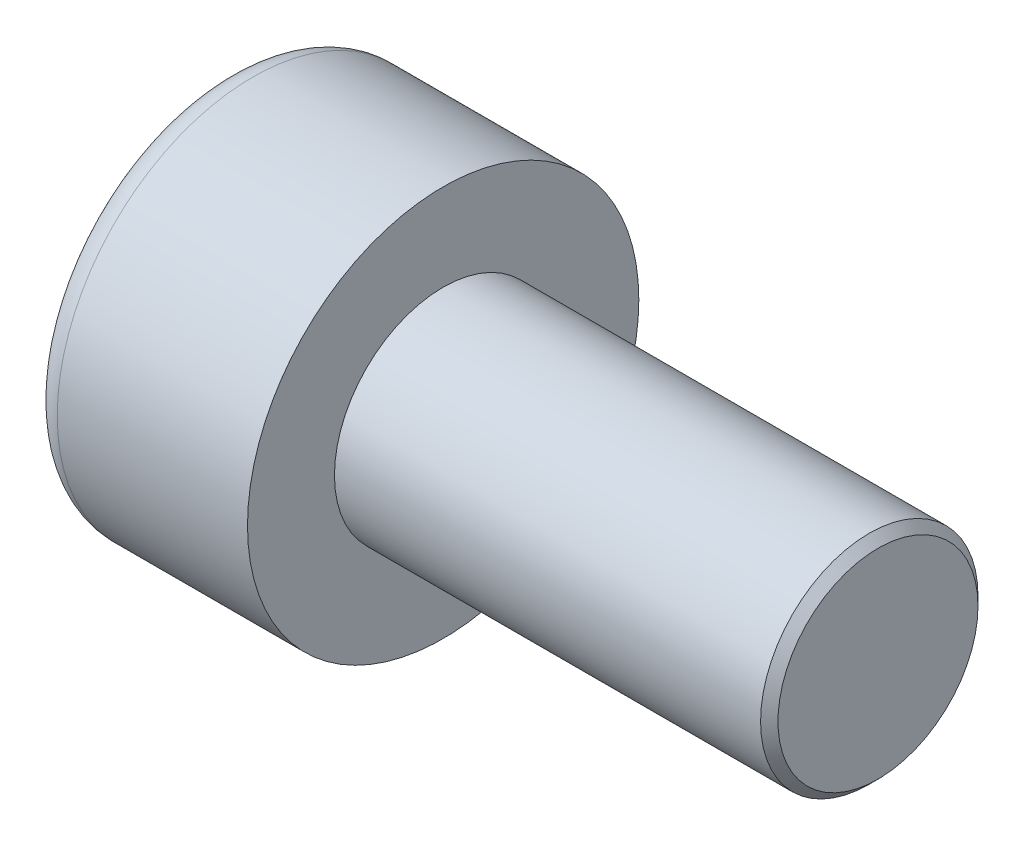
from build123d import *

# Parameters (mm, degrees)
SKETCH1_R           = 2.25
BASEHEAD_DEPTH      = 2.5
SKETCH2_R           = 1.25
BASEBODY_DEPTH      = 5
HEXAGONSOCKET_DEPTH = 1.1
TOPFILLET_R         = 0.3125
CHAMFER1_SIZE       = 0.1


with BuildPart() as part:
    # Sketch1 → BaseHead (new body)
    with BuildSketch(Plane(origin=(0, 0, 0), x_dir=(0, 0, -1), z_dir=(1, 0, 0))):
        Circle(SKETCH1_R)
    extrude(amount=BASEHEAD_DEPTH)

    # Sketch2 → BaseBody (add)
    with BuildSketch(Plane(origin=(2.5, 0, 0), x_dir=(0, 0, -1), z_dir=(1, 0, 0))):
        Circle(SKETCH2_R)
    extrude(amount=BASEBODY_DEPTH)

    # Sketch3 → HexagonSocket (cut)
    with BuildSketch(Plane(origin=(0, 0, 0), x_dir=(0, 0, -1), z_dir=(1, 0, 0))):
        Polygon((1.154700538, 0), (0.577350269, 1), (-0.577350269, 1), (-1.154700538, 0), (-0.577350269, -1), (0.577350269, -1), align=None)
    extrude(amount=HEXAGONSOCKET_DEPTH, mode=Mode.SUBTRACT)

    # Sketch4 → Cut-Revolve1 (revolve, cut)
    with BuildSketch(Plane(origin=(-4.19613823, 0.75, 0), x_dir=(-1, 0, 0), z_dir=(0, 0, 1)), mode=Mode.PRIVATE) as cut_revolve1_sk:
        Polygon((-5.29613823, 1.75), (-5.873488499, 0.75), (-5.29613823, 0.75), align=None)
    revolve(cut_revolve1_sk.sketch.rotate(Axis((0.838992387, 0, 0), (-1, 0, 0)), 90), axis=Axis((0.838992387, 0, 0), (-1, 0, 0)), mode=Mode.SUBTRACT)

    # TopFillet
    topfillet_edges = [part.edges().sort_by_distance(p)[0] for p in [
        (0, 0, 2.25),
    ]]
    fillet(topfillet_edges, radius=TOPFILLET_R)

    # Chamfer1
    chamfer1_edges = [part.edges().sort_by_distance(p)[0] for p in [
        (7.5, 0, 1.25),
    ]]
    chamfer(chamfer1_edges, length=CHAMFER1_SIZE)


solid = part.part
